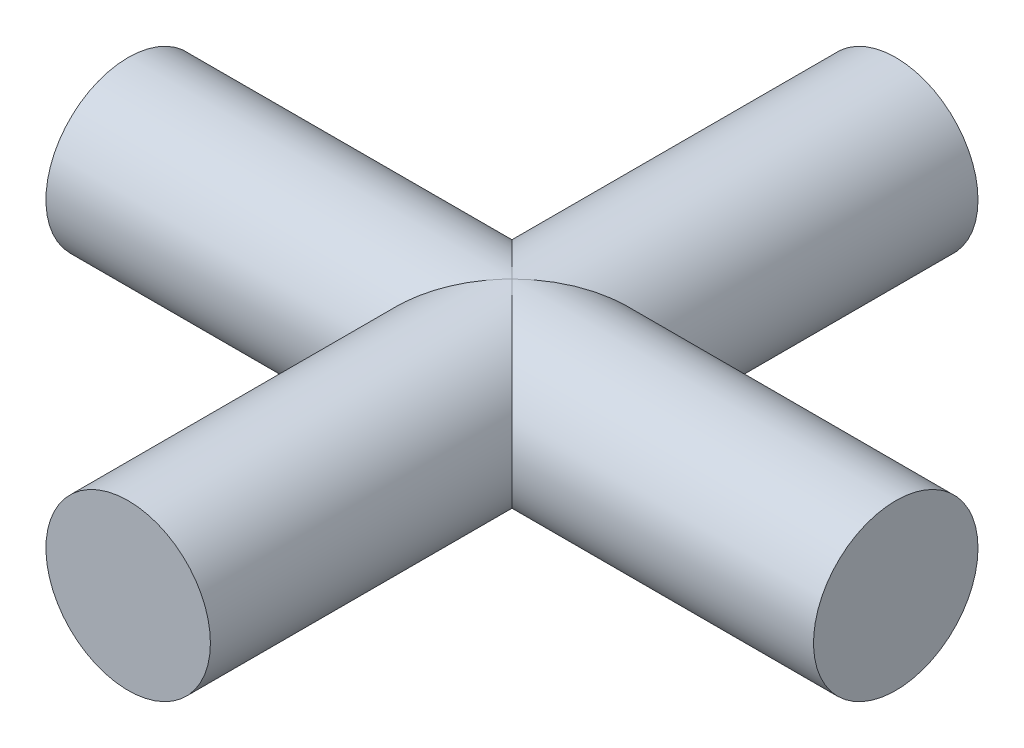
from build123d import *

# Parameters (mm, degrees)
SKETCH_1_R      = 1.5
EXTRUDE_1_DEPTH = 14
SKETCH_2_R      = 1.5
EXTRUDE_2_DEPTH = 7


with BuildPart() as part:
    # 草图1 → 凸台-拉伸1 (new body)
    with BuildSketch(Plane(origin=(0, 0, 0), x_dir=(0, 0, -1), z_dir=(1, 0, 0))):
        Circle(SKETCH_1_R)
    extrude(amount=EXTRUDE_1_DEPTH)

    # 草图2 → 凸台-拉伸2 (add, symmetric)
    with BuildSketch(Plane.XY):
        with Locations(Location((7, 0, 0), (0, 0, 90))):
            Circle(SKETCH_2_R)
    extrude(amount=EXTRUDE_2_DEPTH, both=True)


solid = part.part
